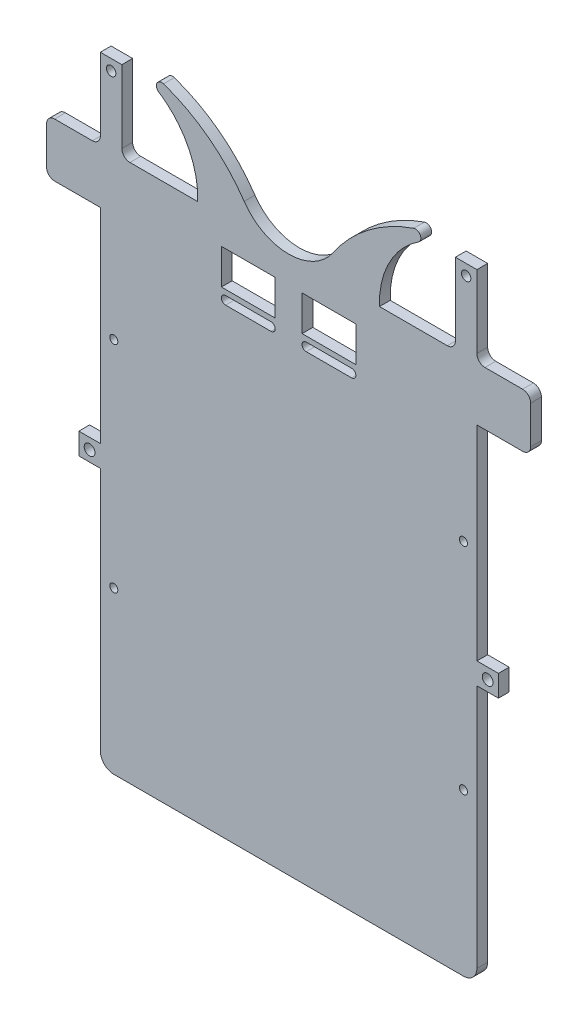
from build123d import *

# Parameters (mm, degrees)
SKETCH_1_W             = 140
SKETCH_1_H             = 200
SKETCH_1_R             = 1.5
EXTRUDE_1_DEPTH        = 4
SKETCH_2_W             = 20
SKETCH_2_H             = 20
EXTRUDE_2_DEPTH        = 4
FILLET_1_R             = 3
FILLET_1_OF_MIRROR_1_R = 3
SKETCH_3_W             = 8
SKETCH_3_H             = 30
SKETCH_3_R             = 1.75
EXTRUDE_3_DEPTH        = 4
FILLET_2_R             = 3
FILLET_2_OF_MIRROR_2_R = 3
FILLET_3_R             = 5
EXTRUDE_4_DEPTH        = 4
SKETCH_5_W             = 8
SKETCH_5_H             = 8
SKETCH_5_R             = 2
EXTRUDE_5_DEPTH        = 4
SKETCH_6_W             = 20
SKETCH_6_H             = 13.1
CUT_EXTRUDE_1_DEPTH    = 10


with BuildPart() as part:
    # 草图1 → 凸台-拉伸1 (new body)
    with BuildSketch(Plane.XY):
        Rectangle(SKETCH_1_W, SKETCH_1_H)
        with Locations((-65, 40)):
            Circle(SKETCH_1_R, mode=Mode.SUBTRACT)
        with Locations(Location((-65, -40, 0), (0, 0, 180))):
            Circle(SKETCH_1_R, mode=Mode.SUBTRACT)
        with Locations((65, -40)):
            Circle(SKETCH_1_R, mode=Mode.SUBTRACT)
        with Locations(Location((65, 40, 0), (0, 0, 180))):
            Circle(SKETCH_1_R, mode=Mode.SUBTRACT)
    extrude(amount=EXTRUDE_1_DEPTH)

    # 草图2 → 凸台-拉伸2 (add)
    with BuildSketch(Plane.XY.offset(4)):
        with Locations((80, 90)):
            Rectangle(SKETCH_2_W, SKETCH_2_H)
    extrude_2 = extrude(amount=-EXTRUDE_2_DEPTH)

    # 圆角1
    fillet_1_edges = [part.edges().sort_by_distance(p)[0] for p in [
        (90, 100, 2),
        (90, 80, 2),
    ]]
    fillet(fillet_1_edges, radius=FILLET_1_R)

    # 镜向1: 凸台-拉伸2 across plane
    add(extrude_2.mirror(Plane(origin=(0, 0, 0), x_dir=(0, 0, 1), z_dir=(1, 0, 0))))

    # 圆角1 of 镜向1
    fillet_1_of_mirror_1_edges = [part.edges().sort_by_distance(p)[0] for p in [
        (-90, 100, 2),
        (-90, 80, 2),
    ]]
    fillet(fillet_1_of_mirror_1_edges, radius=FILLET_1_OF_MIRROR_1_R)

    # 草图3 → 凸台-拉伸3 (add)
    with BuildSketch(Plane.XY.offset(4)):
        with Locations((-66, 115)):
            Rectangle(SKETCH_3_W, SKETCH_3_H)
        with Locations((-66, 126)):
            Circle(SKETCH_3_R, mode=Mode.SUBTRACT)
    extrude_3 = extrude(amount=-EXTRUDE_3_DEPTH)

    # 圆角2
    fillet_2_edges = [part.edges().sort_by_distance(p)[0] for p in [
        (-70, 100, 2),
        (-62, 100, 2),
    ]]
    fillet(fillet_2_edges, radius=FILLET_2_R)

    # 镜向2: 凸台-拉伸3 across plane
    add(extrude_3.mirror(Plane(origin=(0, 0, 0), x_dir=(0, 0, 1), z_dir=(1, 0, 0))))

    # 圆角2 of 镜向2
    fillet_2_of_mirror_2_edges = [part.edges().sort_by_distance(p)[0] for p in [
        (70, 100, 2),
        (62, 100, 2),
    ]]
    fillet(fillet_2_of_mirror_2_edges, radius=FILLET_2_OF_MIRROR_2_R)

    # 圆角3
    fillet_3_edges = [part.edges().sort_by_distance(p)[0] for p in [
        (-70, -100, 2),
        (70, -100, 2),
    ]]
    fillet(fillet_3_edges, radius=FILLET_3_R)

    # 草图4 → 凸台-拉伸4 (add)
    with BuildSketch(Plane(origin=(0, 0, 0), x_dir=(-1, 0, 0), z_dir=(0, 0, -1))):
        with BuildLine():
            add(Edge.make_bspline(
                [(-33.786379938, 100), (-33.384771108, 111.24314249), (-38.944167614, 121.897129031), (-48.25387443, 128.002822688)],
                knots=[0, 0, 0, 0, 0.66194058, 0.66194058, 0.66194058, 0.66194058], degree=3))
            Line((-33.786379938, 100), (0, 100))
            ThreePointArc((0, 100), (-9.331566745, 102.310402433), (-16.507166038, 108.707813791))
            ThreePointArc((-16.507166038, 108.707813791), (-29.663945789, 122.555538901), (-46.506293223, 131.566403293))
            ThreePointArc((-46.506293223, 131.566403293), (-48.952735362, 130.555841868), (-48.25387443, 128.002822688))
        make_face()
        with BuildLine():
            ThreePointArc((16.507166038, 108.707813791), (9.331566745, 102.310402433), (0, 100))
            Line((0, 100), (33.786379938, 100))
            add(Edge.make_bspline(
                [(33.786379938, 100), (33.384771108, 111.24314249), (38.944167614, 121.897129031), (48.25387443, 128.002822688)],
                knots=[0, 0, 0, 0, 0.66194058, 0.66194058, 0.66194058, 0.66194058], degree=3))
            ThreePointArc((48.25387443, 128.002822688), (48.952735362, 130.555841868), (46.506293223, 131.566403293))
            ThreePointArc((46.506293223, 131.566403293), (29.663945789, 122.555538901), (16.507166038, 108.707813791))
        make_face()
    extrude(amount=-EXTRUDE_4_DEPTH)

    # 草图5 → 凸台-拉伸5 (add)
    # profile 1 of 2: a face of its own
    with BuildSketch(Plane.XY.offset(4)):
        with Locations((-74, 0)):
            Rectangle(SKETCH_5_W, SKETCH_5_H)
        with Locations((-74, 0)):
            Circle(SKETCH_5_R, mode=Mode.SUBTRACT)
    # profile 2 of 2: a face of its own
    with BuildSketch(Plane.XY.offset(4)):
        with Locations((74, 0)):
            Rectangle(SKETCH_5_W, SKETCH_5_H)
        with Locations(Location((74, 0, 0), (0, 0, 180))):
            Circle(SKETCH_5_R, mode=Mode.SUBTRACT)
    extrude(amount=-EXTRUDE_5_DEPTH)

    # 草图6 → 切除-拉伸1 (cut)
    with BuildSketch(Plane.XY.offset(4)):
        with Locations((-15, 83.45)):
            Rectangle(SKETCH_6_W, SKETCH_6_H)
        with Locations((15, 83.45)):
            Rectangle(SKETCH_6_W, SKETCH_6_H)
        with BuildLine():
            Line((-23.45, 74.95), (-6.55, 74.95))
            ThreePointArc((-6.55, 74.95), (-5, 73.4), (-6.55, 71.85))
            Line((-6.55, 71.85), (-23.45, 71.85))
            ThreePointArc((-23.45, 71.85), (-25, 73.4), (-23.45, 74.95))
        make_face()
        with BuildLine():
            Line((23.45, 71.85), (6.55, 71.85))
            ThreePointArc((6.55, 71.85), (5, 73.4), (6.55, 74.95))
            Line((6.55, 74.95), (23.45, 74.95))
            ThreePointArc((23.45, 74.95), (25, 73.4), (23.45, 71.85))
        make_face()
    extrude(amount=-CUT_EXTRUDE_1_DEPTH, mode=Mode.SUBTRACT)


solid = part.part
